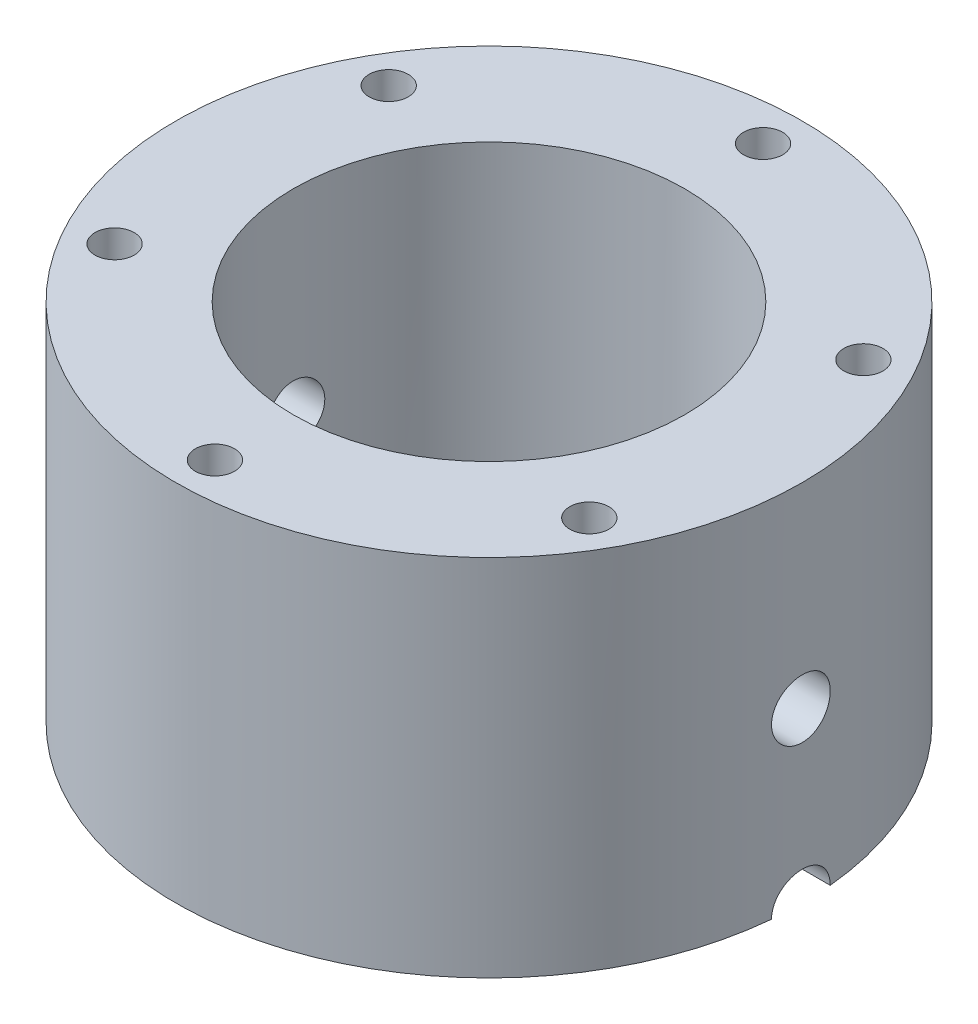
from build123d import *

# Parameters (mm, degrees)
SKETCH1_R                      = 20.32
CYLINDER_DEPTH                 = 26.162
SKETCH18_R                     = 12.7
CUT_EXTRUDE10_DEPTH            = 23.368
SKETCH19_R                     = 1.905
CUT_EXTRUDE12_REACH            = 40.862
SKETCH21_R                     = 1.27
CIRPATTERN4_COUNT              = 6
CUT_EXTRUDE13_REACH            = 39.039
SKETCH22_R                     = 8.001
CUT_EXTRUDE15_REACH            = 54.431
CUT_EXTRUDE15_END_MAJOR_RADIUS = 12.573
CUT_EXTRUDE15_END_MINOR_RADIUS = 1.905
SKETCH25_R                     = 1.905
CIRPATTERN6_COUNT              = 2
SKETCH26_R                     = 1.905
CUT_EXTRUDE16_DEPTH            = 53.430547027
CUT_EXTRUDE17_DEPTH            = 39.862000188
CUT_EXTRUDE17_DEPTH_BACK       = 39.862000188
SKETCH27_W                     = 40.64
SKETCH27_H                     = 2.54


with BuildPart() as part:
    # Sketch1 → Cylinder (new body)
    with BuildSketch(Plane(origin=(0, 0, 0), x_dir=(1, 0, 0), z_dir=(0, 1, 0))):
        with Locations(Location((0, 0, 0), (0, 0, 270))):
            Circle(SKETCH1_R)
    extrude(amount=CYLINDER_DEPTH)

    # Sketch18 → Cut-Extrude10 (cut)
    with BuildSketch(Plane(origin=(0, 26.162, 0), x_dir=(1, 0, 0), z_dir=(0, 1, 0))):
        with Locations(Location((0, 0, 0), (0, 0, 270))):
            Circle(SKETCH18_R)
    extrude(amount=-CUT_EXTRUDE10_DEPTH, mode=Mode.SUBTRACT)

    # Sketch19 → Cut-Revolve7 (revolve, cut)
    with BuildSketch(Plane.XY, mode=Mode.PRIVATE) as cut_revolve7_sk:
        with Locations((12.573, 0)):
            Circle(SKETCH19_R)
    revolve(cut_revolve7_sk.sketch.rotate(Axis((0, 13.335, 0), (0, -1, 0)), 90), axis=Axis((0, 13.335, 0), (0, -1, 0)), mode=Mode.SUBTRACT)

    # Sketch21 → Cut-Extrude12 (cut, up to next)
    with BuildSketch(Plane(origin=(0, 26.162, 0), x_dir=(1, 0, 0), z_dir=(0, 1, 0)), mode=Mode.PRIVATE) as cut_extrude12_sk1:
        with Locations(Location((0, 17.78, 0), (0, 0, 270))):
            Circle(SKETCH21_R)
    cut_extrude12_tool1 = extrude(cut_extrude12_sk1.sketch, amount=-CUT_EXTRUDE12_REACH, mode=Mode.PRIVATE) & part.part
    cut_extrude12 = cut_extrude12_tool1.solids().sort_by_distance((0, 26.162, -17.78))[0]
    add(cut_extrude12, mode=Mode.SUBTRACT)

    # CirPattern4: Cut-Extrude12 ×6 about axis
    cirpattern4_axis = Axis((0, 0, 0), (0, 1, 0))
    for i in range(1, CIRPATTERN4_COUNT):
        add(cut_extrude12.rotate(cirpattern4_axis, i * 360 / CIRPATTERN4_COUNT), mode=Mode.SUBTRACT)

    # Sketch22 → Cut-Extrude13 (cut, up to next)
    with BuildSketch(Plane(origin=(0, 2.794, 0), x_dir=(1, 0, 0), z_dir=(0, 1, 0)), mode=Mode.PRIVATE) as cut_extrude13_sk1:
        with Locations(Location((0, 0, 0), (0, 0, 270))):
            Circle(SKETCH22_R)
    cut_extrude13_tool1 = extrude(cut_extrude13_sk1.sketch, amount=-CUT_EXTRUDE13_REACH, mode=Mode.PRIVATE) & part.part
    add(cut_extrude13_tool1.solids().sort_by_distance((0, 2.794, 0))[0], mode=Mode.SUBTRACT)

    # Cut-Extrude15: up to this torus (the profile starts outside it)
    cut_extrude15_end = Plane(origin=(0, 0, 0), z_dir=(0, 1, 0)) * Torus(CUT_EXTRUDE15_END_MAJOR_RADIUS, CUT_EXTRUDE15_END_MINOR_RADIUS, mode=Mode.PRIVATE)
    # Sketch25 → Cut-Extrude15 (cut, up to the surface)
    with BuildSketch(Plane(origin=(20.32, 0, 0), x_dir=(0, 0, -1), z_dir=(1, 0, 0)), mode=Mode.PRIVATE) as cut_extrude15_sk1:
        Circle(SKETCH25_R)
    cut_extrude15_tool1 = extrude(cut_extrude15_sk1.sketch, amount=-CUT_EXTRUDE15_REACH, mode=Mode.PRIVATE) - cut_extrude15_end
    cut_extrude15 = cut_extrude15_tool1.solids().sort_by_distance((20.32, 0, 0))[0]
    add(cut_extrude15, mode=Mode.SUBTRACT)

    # CirPattern6: Cut-Extrude15 ×2 about axis
    cirpattern6_axis = Axis((0, 13.335, 0), (0, -1, 0))
    for i in range(1, CIRPATTERN6_COUNT):
        add(cut_extrude15.rotate(cirpattern6_axis, i * 360 / CIRPATTERN6_COUNT), mode=Mode.SUBTRACT)

    # Sketch26 → Cut-Extrude16 (cut, through all)
    with BuildSketch(Plane(origin=(20.32, 0, 0), x_dir=(0, 0, -1), z_dir=(1, 0, 0))):
        with Locations((0, 10.922)):
            Circle(SKETCH26_R)
    extrude(amount=-CUT_EXTRUDE16_DEPTH, mode=Mode.SUBTRACT)

    # Sketch27 → Cut-Extrude17 (cut, two sides: drawn at the far end of the back side and taken through both)
    with BuildSketch(Plane.XY.offset(-CUT_EXTRUDE17_DEPTH_BACK)):
        with Locations((0, 24.892)):
            Rectangle(SKETCH27_W, SKETCH27_H)
    extrude(amount=CUT_EXTRUDE17_DEPTH + CUT_EXTRUDE17_DEPTH_BACK, mode=Mode.SUBTRACT)


solid = part.part
